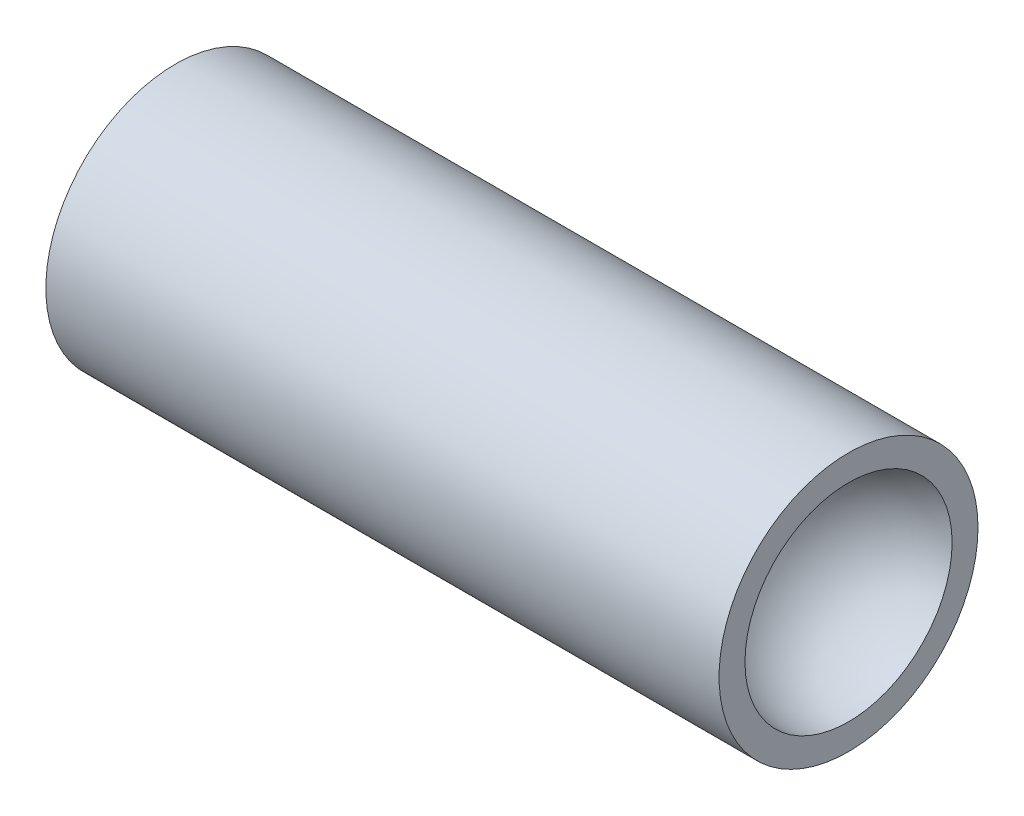
from build123d import *

# Parameters (mm, degrees)
SKETCH1_R           = 25
BOSS_EXTRUDE1_DEPTH = 130
SKETCH3_R           = 20
CUT_EXTRUDE1_DEPTH  = 100


with BuildPart() as part:
    # Sketch1 → Boss-Extrude1 (new body)
    with BuildSketch(Plane(origin=(0, 0, 0), x_dir=(0, 0, -1), z_dir=(1, 0, 0))):
        Circle(SKETCH1_R)
    extrude(amount=BOSS_EXTRUDE1_DEPTH)

    # Sketch2 → Cut-Revolve3 (revolve, cut)
    with BuildSketch(Plane(origin=(130, 0, 0), x_dir=(0, 0, -1), z_dir=(1, 0, 0))):
        with BuildLine():
            Line((-20, 0), (20, 0))
            ThreePointArc((20, 0), (0, 20), (-20, 0))
        make_face()
    revolve(axis=Axis((130, 0, 20), (0, 0, -1)), mode=Mode.SUBTRACT)

    # Sketch3 → Cut-Extrude1 (cut)
    with BuildSketch(Plane.ZY):
        Circle(SKETCH3_R)
    extrude(amount=-CUT_EXTRUDE1_DEPTH, mode=Mode.SUBTRACT)


solid = part.part
